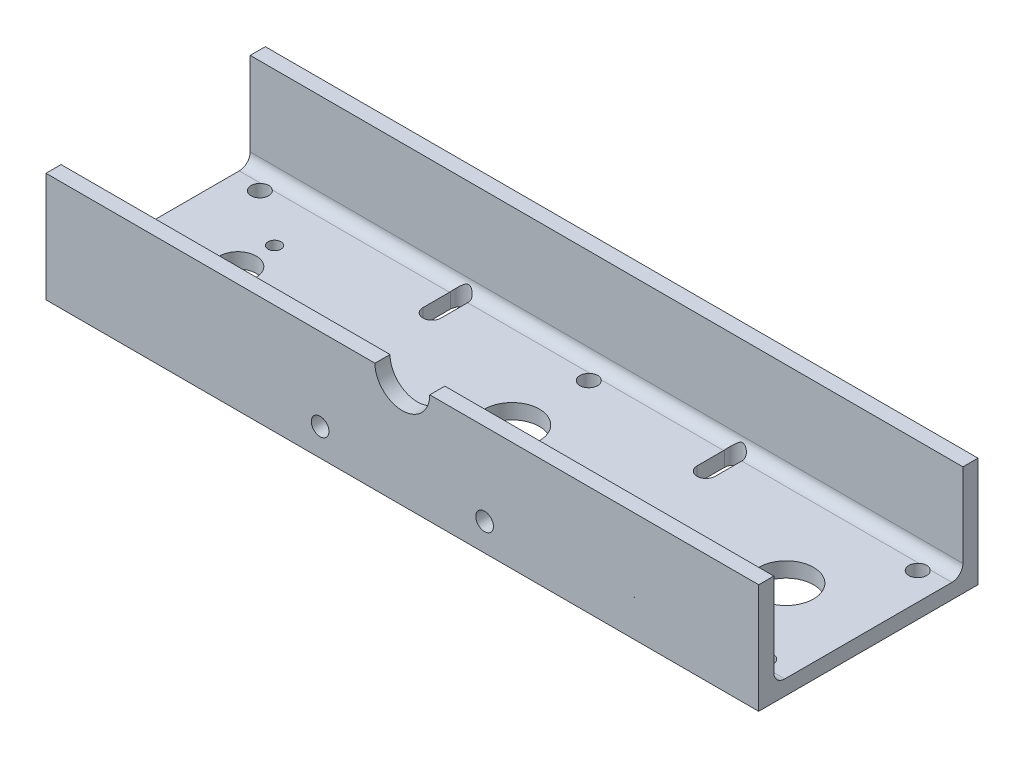
from build123d import *

# Parameters (mm, degrees)
BOSS_EXTRUDE1_DEPTH = 165.1
SKETCH2_R           = 4.25
SKETCH2_R_2         = 6.35
SKETCH2_R_3         = 1.5
CUT_EXTRUDE1_DEPTH  = 11.938
SKETCH3_R           = 2.1
CUT_EXTRUDE2_DEPTH  = 7.874
CUT_EXTRUDE3_DEPTH  = 12.446
SKETCH5_R           = 2.05
CUT_EXTRUDE4_DEPTH  = 6.35
SKETCH6_R           = 2.05
CUT_EXTRUDE5_DEPTH  = 6.35


with BuildPart() as part:
    # Sketch1 → Boss-Extrude1 (new body)
    with BuildSketch(Plane(origin=(0, 0, 0), x_dir=(0, 0, -1), z_dir=(1, 0, 0))):
        with BuildLine():
            Line((-21.9075, -6.6675), (-21.9075, 9.2075))
            Line((-21.9075, 9.2075), (-21.9075, 12.7))
            Line((-21.9075, 12.7), (-25.4, 12.7))
            Line((-25.4, 12.7), (-25.4, -12.7))
            Line((-25.4, -12.7), (25.4, -12.7))
            Line((25.4, -12.7), (25.4, 12.7))
            Line((25.4, 12.7), (21.9075, 12.7))
            Line((21.9075, 12.7), (21.9075, 9.2075))
            Line((21.9075, 9.2075), (21.9075, -6.6675))
            ThreePointArc((21.9075, -6.6675), (21.163551224, -8.463551224), (19.3675, -9.2075))
            Line((19.3675, -9.2075), (-19.3675, -9.2075))
            ThreePointArc((-19.3675, -9.2075), (-21.163551224, -8.463551224), (-21.9075, -6.6675))
        make_face()
    extrude(amount=BOSS_EXTRUDE1_DEPTH)

    # Sketch2 → Cut-Extrude1 (cut)
    with BuildSketch(Plane.XZ.offset(12.7)):
        with Locations(Location((19.05, 0, 0), (0, 0, 270))):
            Circle(SKETCH2_R)
        with Locations(Location((146.05, 0, 0), (0, 0, 270))):
            Circle(SKETCH2_R_2)
        with Locations(Location((19.05, 8.5, 0), (0, 0, 270))):
            Circle(SKETCH2_R_3)
        with Locations(Location((19.05, -8.5, 0), (0, 0, 270))):
            Circle(SKETCH2_R_3)
        with Locations(Location((82.55, 0, 0), (0, 0, 270))):
            Circle(SKETCH2_R_2)
    extrude(amount=-CUT_EXTRUDE1_DEPTH, mode=Mode.SUBTRACT)

    # Sketch3 → Cut-Extrude2 (cut)
    with BuildSketch(Plane.XZ.offset(12.7)):
        with BuildLine():
            Line((52.9, 16.397413762), (52.9, 19.572413762))
            ThreePointArc((52.9, 19.572413762), (50.8, 21.672413762), (48.7, 19.572413762))
            Line((48.7, 19.572413762), (48.7, 16.397413762))
            ThreePointArc((48.7, 16.397413762), (50.8, 18.497413762), (52.9, 16.397413762))
        make_face()
        with Locations((50.8, 16.397413762)):
            Circle(SKETCH3_R)
        with BuildLine():
            Line((52.9, 13.222413762), (52.9, 16.397413762))
            ThreePointArc((52.9, 16.397413762), (50.8, 14.297413762), (48.7, 16.397413762))
            Line((48.7, 16.397413762), (48.7, 13.222413762))
            ThreePointArc((48.7, 13.222413762), (50.8, 11.122413762), (52.9, 13.222413762))
        make_face()
        with BuildLine():
            ThreePointArc((116.4, 13.222413762), (114.3, 11.122413762), (112.2, 13.222413762))
            Line((112.2, 13.222413762), (112.2, 19.572413762))
            ThreePointArc((112.2, 19.572413762), (114.3, 21.672413762), (116.4, 19.572413762))
            Line((116.4, 19.572413762), (116.4, 13.222413762))
        make_face()
        with BuildLine():
            Line((52.9, -19.572413762), (52.9, -13.222413762))
            ThreePointArc((52.9, -13.222413762), (50.8, -11.122413762), (48.7, -13.222413762))
            Line((48.7, -13.222413762), (48.7, -19.572413762))
            ThreePointArc((48.7, -19.572413762), (50.8, -21.672413762), (52.9, -19.572413762))
        make_face()
        with BuildLine():
            Line((112.2, -19.572413762), (112.2, -13.222413762))
            ThreePointArc((112.2, -13.222413762), (114.3, -11.122413762), (116.4, -13.222413762))
            Line((116.4, -13.222413762), (116.4, -19.572413762))
            ThreePointArc((116.4, -19.572413762), (114.3, -21.672413762), (112.2, -19.572413762))
        make_face()
    extrude(amount=-CUT_EXTRUDE2_DEPTH, mode=Mode.SUBTRACT)

    # Sketch4 → Cut-Extrude3 (cut)
    with BuildSketch(Plane.XY.offset(25.4)):
        with BuildLine():
            ThreePointArc((76.2, 12.7), (78.053929045, 8.21582271), (82.533179833, 6.350022277))
            Line((82.533179833, 6.350022277), (82.536543857, 12.7))
            Line((82.536543857, 12.7), (76.2, 12.7))
        make_face()
        with BuildLine():
            Line((82.536543857, 12.7), (82.533179833, 6.350022277))
            ThreePointArc((82.533179833, 6.350022277), (87.03417729, 8.203929045), (88.9, 12.7))
            Line((88.9, 12.7), (82.536543857, 12.7))
        make_face()
        with BuildLine():
            Line((76.2, 12.7), (82.536543857, 12.7))
            Line((82.536543857, 12.7), (82.539907889, 19.04999198))
            ThreePointArc((82.539907889, 19.04999198), (78.056305256, 17.186558542), (76.2, 12.7))
        make_face()
        with BuildLine():
            Line((82.539907889, 19.04999198), (82.536543857, 12.7))
            Line((82.536543857, 12.7), (88.9, 12.7))
            ThreePointArc((88.9, 12.7), (87.036558542, 17.193694744), (82.539907889, 19.04999198))
        make_face()
    extrude(amount=-CUT_EXTRUDE3_DEPTH, mode=Mode.SUBTRACT)

    # Sketch5 → Cut-Extrude4 (cut)
    with BuildSketch(Plane.XZ.offset(12.7)):
        with Locations(Location((6.35, 17.78, 0), (0, 0, 270))):
            Circle(SKETCH5_R)
        with Locations(Location((6.35, -17.78, 0), (0, 0, 270))):
            Circle(SKETCH5_R)
        with Locations(Location((82.55, -17.78, 0), (0, 0, 270))):
            Circle(SKETCH5_R)
        with Locations(Location((158.75, -17.78, 0), (0, 0, 270))):
            Circle(SKETCH5_R)
        with Locations(Location((82.55, 17.78, 0), (0, 0, 270))):
            Circle(SKETCH5_R)
        with Locations(Location((158.75, 17.78, 0), (0, 0, 270))):
            Circle(SKETCH5_R)
    extrude(amount=-CUT_EXTRUDE4_DEPTH, mode=Mode.SUBTRACT)

    # Sketch6 → Cut-Extrude5 (cut)
    with BuildSketch(Plane.XY.offset(25.4)):
        with Locations((101.6, -6.35)):
            Circle(SKETCH6_R)
        with Locations((63.5, -6.35)):
            Circle(SKETCH6_R)
    extrude(amount=-CUT_EXTRUDE5_DEPTH, mode=Mode.SUBTRACT)


solid = part.part
